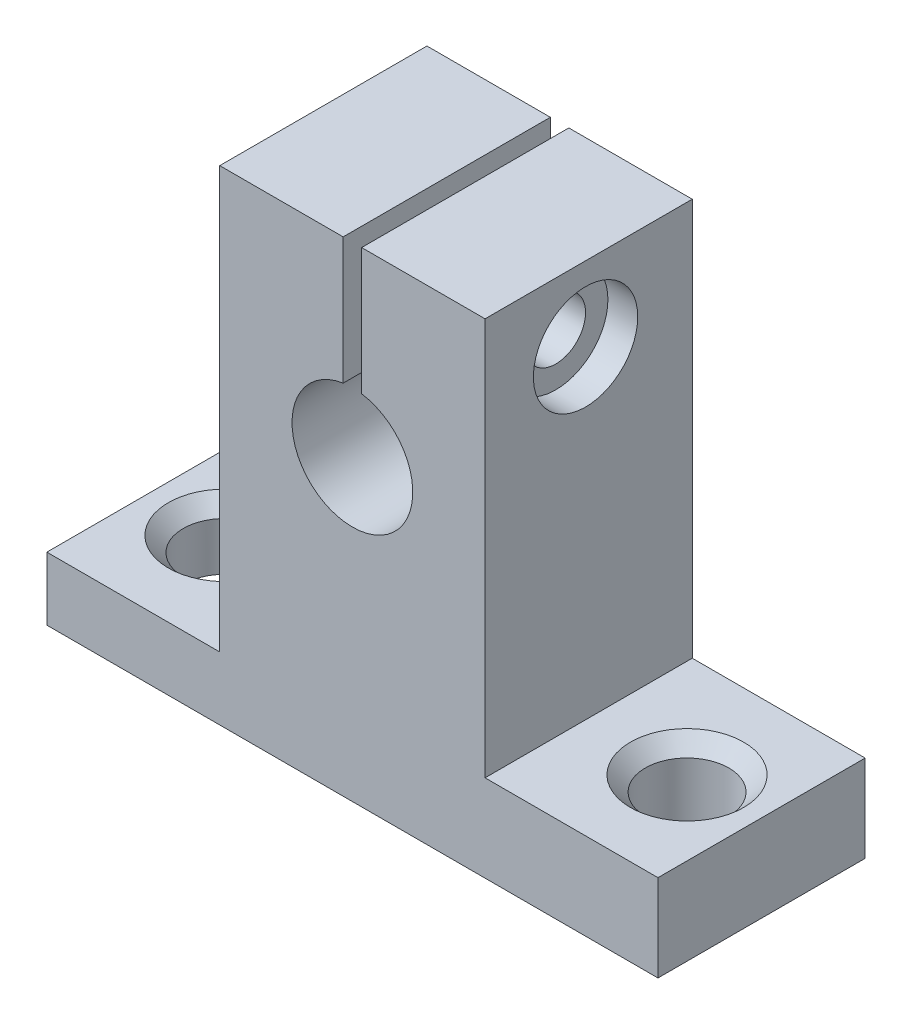
from build123d import *

# Parameters (mm, degrees)
EXTRUDE_1_DEPTH     = 13900
SKETCH_2_R          = 2800
CUT_EXTRUDE_1_DEPTH = 13900
CHAMFER_1_SIZE      = 1000
SKETCH_3_R          = 3500
CUT_EXTRUDE_3_DEPTH = 2000
SKETCH_10_R         = 2000
CUT_EXTRUDE_4_DEPTH = 24538


with BuildPart() as part:
    # 草圖1 → 填料-伸長1 (new body)
    with BuildSketch(Plane.XY):
        with BuildLine():
            Line((0, 0), (41000, 0))
            Line((41000, 0), (41000, 5830))
            Line((41000, 5830), (29400, 5830))
            Line((29400, 5830), (29400, 32500))
            Line((29400, 32500), (21120, 32500))
            Line((21120, 32500), (21120, 24002.261860498))
            ThreePointArc((21120, 24002.261860498), (20500, 15950), (19880, 24002.261860498))
            Line((19880, 24002.261860498), (19880, 32500))
            Line((19880, 32500), (11600, 32500))
            Line((11600, 32500), (11600, 4243.440233236))
            Line((11600, 4243.440233236), (0, 4243.440233236))
            Line((0, 4243.440233236), (0, 0))
        make_face()
    extrude(amount=EXTRUDE_1_DEPTH)

    # 草圖2 → 除料-伸長1 (cut)
    with BuildSketch(Plane(origin=(0, 5830, 0), x_dir=(1, 0, 0), z_dir=(0, 1, 0))):
        with Locations(Location((36000, -6950, 0), (0, 0, 180))):
            Circle(SKETCH_2_R)
        with Locations(Location((5000, -6950, 0), (0, 0, 270))):
            Circle(SKETCH_2_R)
    extrude(amount=-CUT_EXTRUDE_1_DEPTH, mode=Mode.SUBTRACT)

    # 導角1
    chamfer_1_edges = [part.edges().sort_by_distance(p)[0] for p in [
        (38800, 5830, 6950),
        (5000, 4243.440233236, 4150),
    ]]
    chamfer(chamfer_1_edges, length=CHAMFER_1_SIZE)

    # 草圖3 → 除料-伸長3 (cut)
    with BuildSketch(Plane(origin=(29400, 0, 0), x_dir=(0, 0, -1), z_dir=(1, 0, 0))):
        with Locations((-7158.276347715, 27500)):
            Circle(SKETCH_3_R)
    extrude(amount=-CUT_EXTRUDE_3_DEPTH, mode=Mode.SUBTRACT)

    # 草圖10 → 除料-伸長4 (cut)
    with BuildSketch(Plane(origin=(27400, 0, 0), x_dir=(0, 0, -1), z_dir=(1, 0, 0))):
        with Locations((-7158.276347715, 27500)):
            Circle(SKETCH_10_R)
    extrude(amount=-CUT_EXTRUDE_4_DEPTH, mode=Mode.SUBTRACT)


solid = part.part
